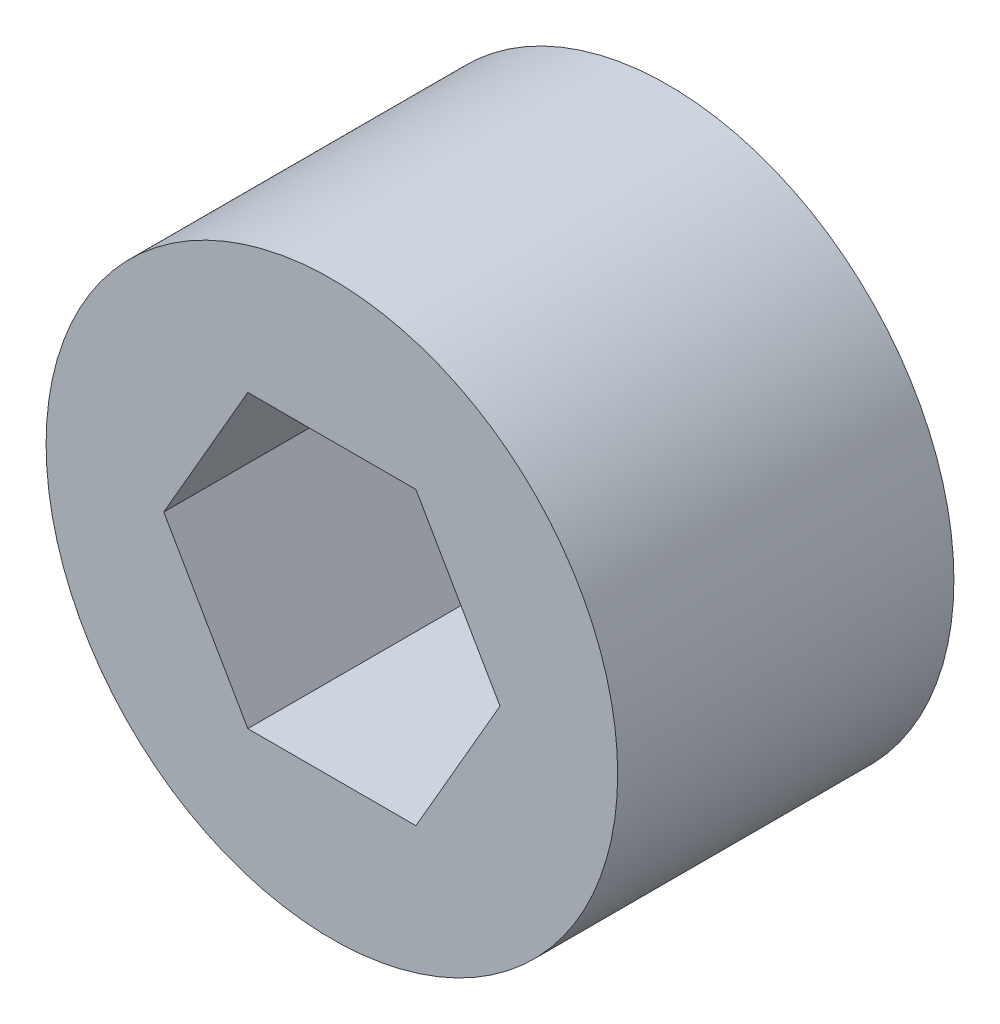
from build123d import *

# Parameters (mm, degrees)
SKETCH_1_R      = 8.5
EXTRUDE_1_DEPTH = 10


with BuildPart() as part:
    # 草图1 → 凸台-拉伸1 (new body)
    with BuildSketch(Plane.XY):
        Circle(SKETCH_1_R)
        Polygon((2.5, -4.330127019), (5, 0), (2.5, 4.330127019), (-2.5, 4.330127019), (-5, 0), (-2.5, -4.330127019), align=None, mode=Mode.SUBTRACT)
    extrude(amount=EXTRUDE_1_DEPTH)


solid = part.part
